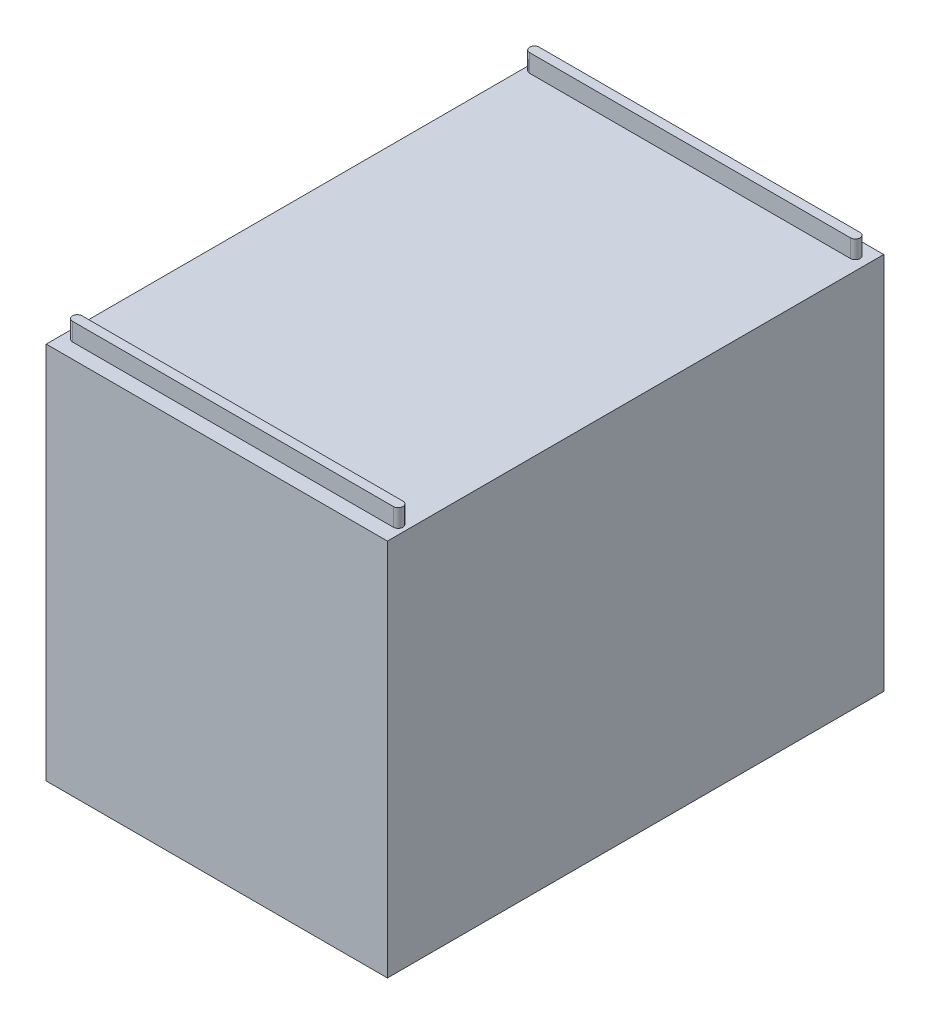
from build123d import *

# Parameters (mm, degrees)
SKETCH1_W           = 82.927984002
SKETCH1_H           = 63.220938657
BOSS_EXTRUDE1_DEPTH = 2
SKETCH2_W           = 82.927984002
SKETCH2_H           = 3.465808433
BOSS_EXTRUDE2_DEPTH = 55
SKETCH3_W           = 82.927984002
SKETCH3_H           = 3.967313271
BOSS_EXTRUDE3_DEPTH = 55
SKETCH4_W           = 4.221872701
SKETCH4_H           = 55.787816953
BOSS_EXTRUDE4_DEPTH = 55
SKETCH5_W           = 55
SKETCH5_H           = 3.935807591
BOSS_EXTRUDE5_DEPTH = 59
SKETCH6_W           = 41.500434797
SKETCH6_H           = 30.602093287
CUT_EXTRUDE1_DEPTH  = 59
SKETCH7_W           = 44.576665198
SKETCH7_H           = 66.696896342
BOSS_EXTRUDE6_DEPTH = 1.00351002
SKETCH8_W           = 10.465984431
SKETCH8_H           = 14.175880316
BOSS_EXTRUDE7_DEPTH = 2.561499725
BOSS_EXTRUDE8_DEPTH = 3
SKETCH13_W          = 82.927984002
SKETCH13_H          = 63.220938657
BOSS_EXTRUDE9_DEPTH = 1


with BuildPart() as part:
    # Sketch1 → Boss-Extrude1 (new body)
    with BuildSketch(Plane(origin=(0, 0, 0), x_dir=(0, 0, -1), z_dir=(1, 0, 0))):
        with Locations((-67.649308223, 19.885127524)):
            Rectangle(SKETCH1_W, SKETCH1_H)
    extrude(amount=BOSS_EXTRUDE1_DEPTH)

    # Sketch2 → Boss-Extrude2 (add)
    with BuildSketch(Plane(origin=(2, 0, 0), x_dir=(0, 0, -1), z_dir=(1, 0, 0))):
        with Locations((-67.649308223, 49.762692636)):
            Rectangle(SKETCH2_W, SKETCH2_H)
    extrude(amount=BOSS_EXTRUDE2_DEPTH)

    # Sketch3 → Boss-Extrude3 (add)
    with BuildSketch(Plane(origin=(2, 0, 0), x_dir=(0, 0, -1), z_dir=(1, 0, 0))):
        with Locations((-67.649308223, -9.74168517)):
            Rectangle(SKETCH3_W, SKETCH3_H)
    extrude(amount=BOSS_EXTRUDE3_DEPTH)

    # Sketch4 → Boss-Extrude4 (add)
    with BuildSketch(Plane(origin=(2, 0, 0), x_dir=(0, 0, -1), z_dir=(1, 0, 0))):
        with Locations((-107.002363874, 20.135879943)):
            Rectangle(SKETCH4_W, SKETCH4_H)
    extrude(amount=BOSS_EXTRUDE4_DEPTH)

    # Sketch5 → Boss-Extrude5 (add)
    with BuildSketch(Plane(origin=(0, 48.029788419, 0), x_dir=(-1, 0, 0), z_dir=(0, -1, 0))):
        with Locations((-29.5, -28.153220018)):
            Rectangle(SKETCH5_W, SKETCH5_H)
    extrude(amount=BOSS_EXTRUDE5_DEPTH)

    # Sketch6 → Cut-Extrude1 (cut)
    with BuildSketch(Plane.ZY):
        with Locations((77.408781478, 14.741773436)):
            Rectangle(SKETCH6_W, SKETCH6_H)
    extrude(amount=-CUT_EXTRUDE1_DEPTH, mode=Mode.SUBTRACT)

    # Sketch7 → Boss-Extrude6 (add)
    with BuildSketch(Plane(origin=(0, 48.029788419, -1.234575524), x_dir=(-1, 0, 0), z_dir=(0, -1, 0))):
        with Locations((-29.385955108, -71.399525652)):
            Rectangle(SKETCH7_W, SKETCH7_H)
    extrude(amount=BOSS_EXTRUDE6_DEPTH)

    # Sketch8 → Boss-Extrude7 (add)
    with BuildSketch(Plane(origin=(2, 0, -3.365196523), x_dir=(0, 0, -1), z_dir=(1, 0, 0))):
        with Locations((-45.445727025, 7.087940158)):
            Rectangle(SKETCH8_W, SKETCH8_H)
    extrude(amount=BOSS_EXTRUDE7_DEPTH)

    # Sketch9 → Boss-Extrude8 (add)
    with BuildSketch(Plane(origin=(0, 51.495596852, 0), x_dir=(1, 0, 0), z_dir=(0, 1, 0))):
        with BuildLine():
            Line((1.887912496, -105.030139818), (55.50324265, -105.030139818))
            ThreePointArc((55.50324265, -105.030139818), (56.295978023, -105.822875191), (55.50324265, -106.615610564))
            Line((55.50324265, -106.615610564), (1.887912496, -106.615610564))
            ThreePointArc((1.887912496, -106.615610564), (1.095177123, -105.822875191), (1.887912496, -105.030139818))
        make_face()
        with BuildLine():
            Line((1.206362126, -27.966631884), (54.82169228, -27.966631884))
            ThreePointArc((54.82169228, -27.966631884), (55.614427653, -28.759367257), (54.82169228, -29.552102629))
            Line((54.82169228, -29.552102629), (1.206362126, -29.552102629))
            ThreePointArc((1.206362126, -29.552102629), (0.413626753, -28.759367257), (1.206362126, -27.966631884))
        make_face()
    extrude(amount=BOSS_EXTRUDE8_DEPTH)

    # Sketch13 → Boss-Extrude9 (add)
    with BuildSketch(Plane(origin=(57, 0, 0), x_dir=(0, 0, -1), z_dir=(1, 0, 0))):
        with Locations((-67.649308223, 19.885127524)):
            Rectangle(SKETCH13_W, SKETCH13_H)
    extrude(amount=-BOSS_EXTRUDE9_DEPTH)


solid = part.part
